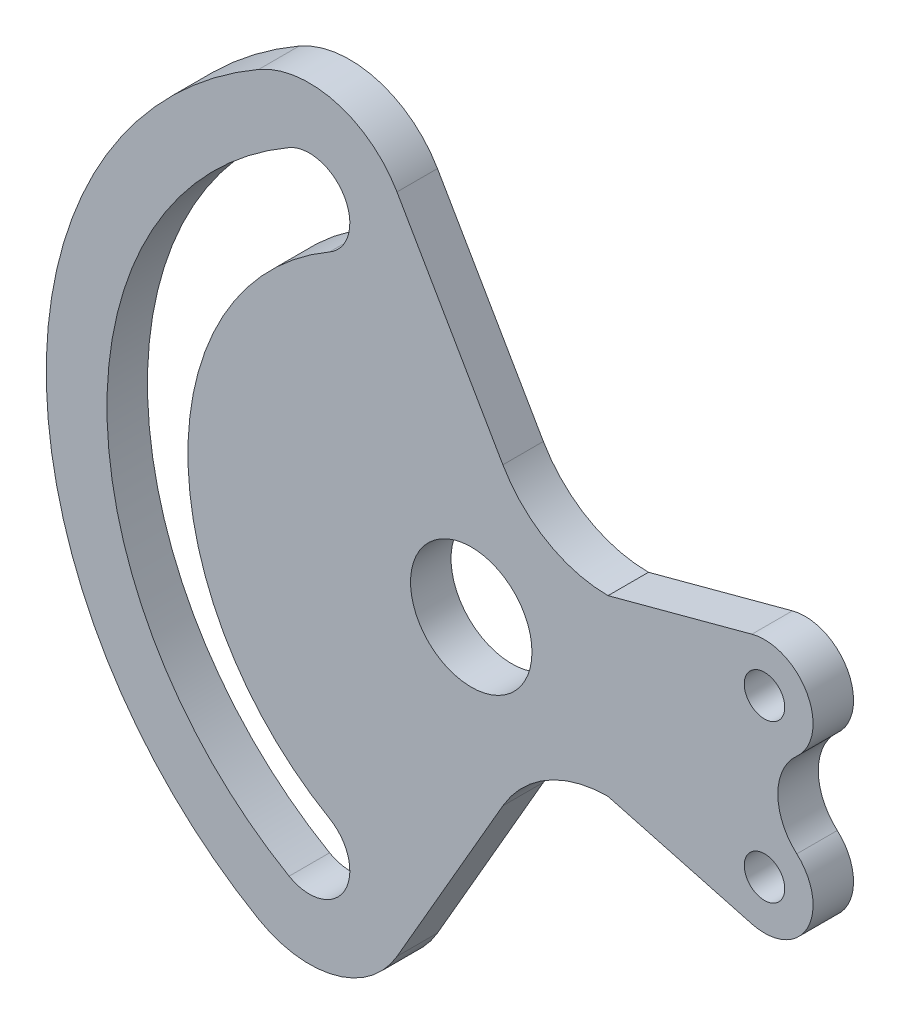
from build123d import *

# Parameters (mm, degrees)
SKETCH1_R           = 15
SKETCH1_R_2         = 5
BOSS_EXTRUDE1_DEPTH = 10


with BuildPart() as part:
    # Sketch1 → Boss-Extrude1 (new body)
    with BuildSketch(Plane.XY):
        with BuildLine():
            Line((69.33860843, 31.002538298), (33.788342918, 21.476873363))
            ThreePointArc((33.788342918, 21.476873363), (18.788342918, 25.49611125), (7.807580804, 36.476873363))
            Line((7.807580804, 36.476873363), (-18.349364905, 81.782032303))
            ThreePointArc((-18.349364905, 81.782032303), (-33.529523872, 93.43017796), (-52.5, 90.932667397))
            ThreePointArc((-52.5, 90.932667397), (-105, 0), (-52.5, -90.932667397))
            ThreePointArc((-52.5, -90.932667397), (-33.529523872, -93.43017796), (-18.349364905, -81.782032303))
            Line((-18.349364905, -81.782032303), (7.807580804, -36.476873363))
            ThreePointArc((7.807580804, -36.476873363), (18.788342918, -25.49611125), (33.788342918, -21.476873363))
            Line((33.788342918, -21.476873363), (69.33860843, -31.002538298))
            ThreePointArc((69.33860843, -31.002538298), (83.00500475, -25.110060517), (80.427804346, -10.452307591))
            ThreePointArc((80.427804346, -10.452307591), (75.741732949, 0), (80.427804346, 10.452307591))
            ThreePointArc((80.427804346, 10.452307591), (83.00500475, 25.110060517), (69.33860843, 31.002538298))
        make_face()
        Circle(SKETCH1_R, mode=Mode.SUBTRACT)
        with Locations((72.444436972, 19.411428383)):
            Circle(SKETCH1_R_2, mode=Mode.SUBTRACT)
        with Locations(Location((72.444436972, -19.411428383, 0), (0, 0, 180))):
            Circle(SKETCH1_R_2, mode=Mode.SUBTRACT)
        with BuildLine():
            ThreePointArc((-45, 77.942286341), (-90, 0), (-45, -77.942286341))
            ThreePointArc((-45, -77.942286341), (-31.339745962, -74.282032303), (-35, -60.621778265))
            ThreePointArc((-35, -60.621778265), (-70, 0), (-35, 60.621778265))
            ThreePointArc((-35, 60.621778265), (-31.339745962, 74.282032303), (-45, 77.942286341))
        make_face(mode=Mode.SUBTRACT)
    extrude(amount=BOSS_EXTRUDE1_DEPTH)


solid = part.part
